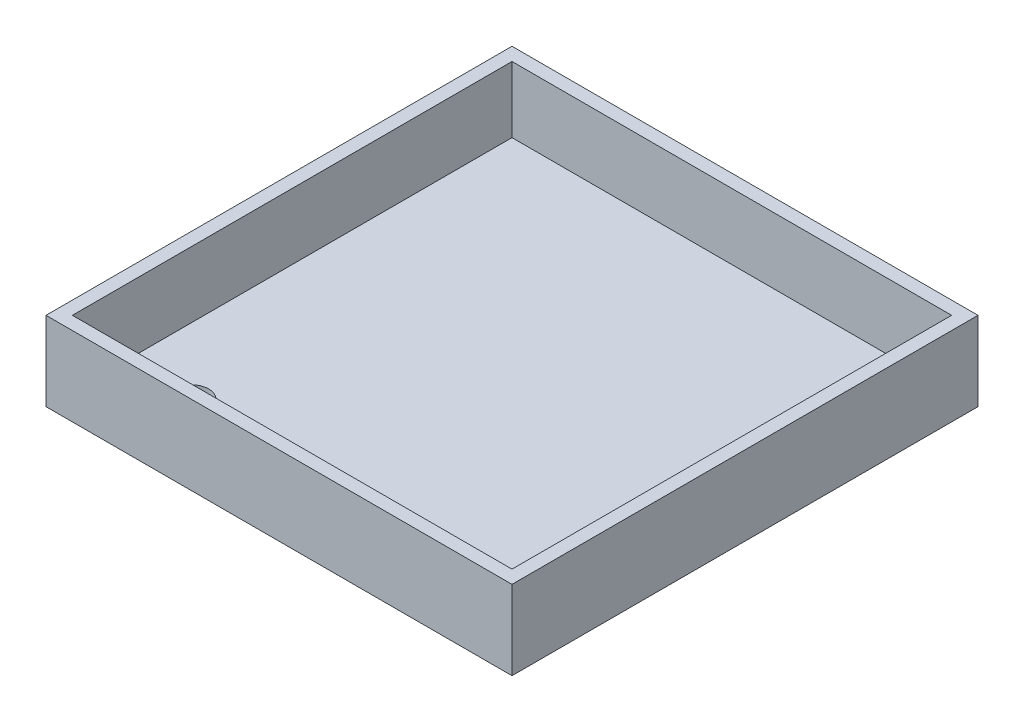
from build123d import *

# Parameters (mm, degrees)
SKETCH3_W             = 100
SKETCH3_H             = 100
BOSS_EXTRUDE1_DEPTH   = 3
SKETCH5_W             = 100
SKETCH5_H             = 18
BOSS_EXTRUDE2_DEPTH   = 3
SKETCH6_W             = 100
SKETCH6_H             = 18
BOSS_EXTRUDE3_DEPTH   = 3
SKETCH7_W             = 106
SKETCH7_H             = 18
BOSS_EXTRUDE4_DEPTH   = 3
SKETCH9_W             = 106
SKETCH9_H             = 18
BOSS_EXTRUDE5_DEPTH   = 3
F_8_0MM_DOWEL_HOLE1_D = 8
F_4_0MM_DOWEL_HOLE1_D = 4


with BuildPart() as part:
    # Sketch3 → Boss-Extrude1 (new body)
    with BuildSketch(Plane(origin=(0, 0, 0), x_dir=(1, 0, 0), z_dir=(0, 1, 0))):
        with Locations((50, -50)):
            Rectangle(SKETCH3_W, SKETCH3_H)
    extrude(amount=BOSS_EXTRUDE1_DEPTH)

    # Sketch5 → Boss-Extrude2 (add)
    with BuildSketch(Plane.XY.offset(100)):
        with Locations((50, 9)):
            Rectangle(SKETCH5_W, SKETCH5_H)
    extrude(amount=BOSS_EXTRUDE2_DEPTH)

    # Sketch6 → Boss-Extrude3 (add)
    with BuildSketch(Plane(origin=(0, 0, 0), x_dir=(-1, 0, 0), z_dir=(0, 0, -1))):
        with Locations((-50, 9)):
            Rectangle(SKETCH6_W, SKETCH6_H)
    extrude(amount=BOSS_EXTRUDE3_DEPTH)

    # Sketch7 → Boss-Extrude4 (add)
    with BuildSketch(Plane.ZY):
        with Locations((50, 9)):
            Rectangle(SKETCH7_W, SKETCH7_H)
    extrude(amount=BOSS_EXTRUDE4_DEPTH)

    # Sketch9 → Boss-Extrude5 (add)
    with BuildSketch(Plane(origin=(100, 0, 0), x_dir=(0, 0, -1), z_dir=(1, 0, 0))):
        with Locations((-50, 9)):
            Rectangle(SKETCH9_W, SKETCH9_H)
    extrude(amount=BOSS_EXTRUDE5_DEPTH)

    # Ø8.0mm Dowel Hole1 (through all)
    with Locations(Plane(origin=(0, 3, 0), x_dir=(1, 0, 0), z_dir=(0, 1, 0))):
        with Locations((15, -88)):
            Hole(F_8_0MM_DOWEL_HOLE1_D / 2)

    # Ø4.0mm Dowel Hole1 (through all)
    with Locations(Plane(origin=(0, 3, 0), x_dir=(1, 0, 0), z_dir=(0, 1, 0))):
        with Locations((89, -88)):
            Hole(F_4_0MM_DOWEL_HOLE1_D / 2)


solid = part.part
